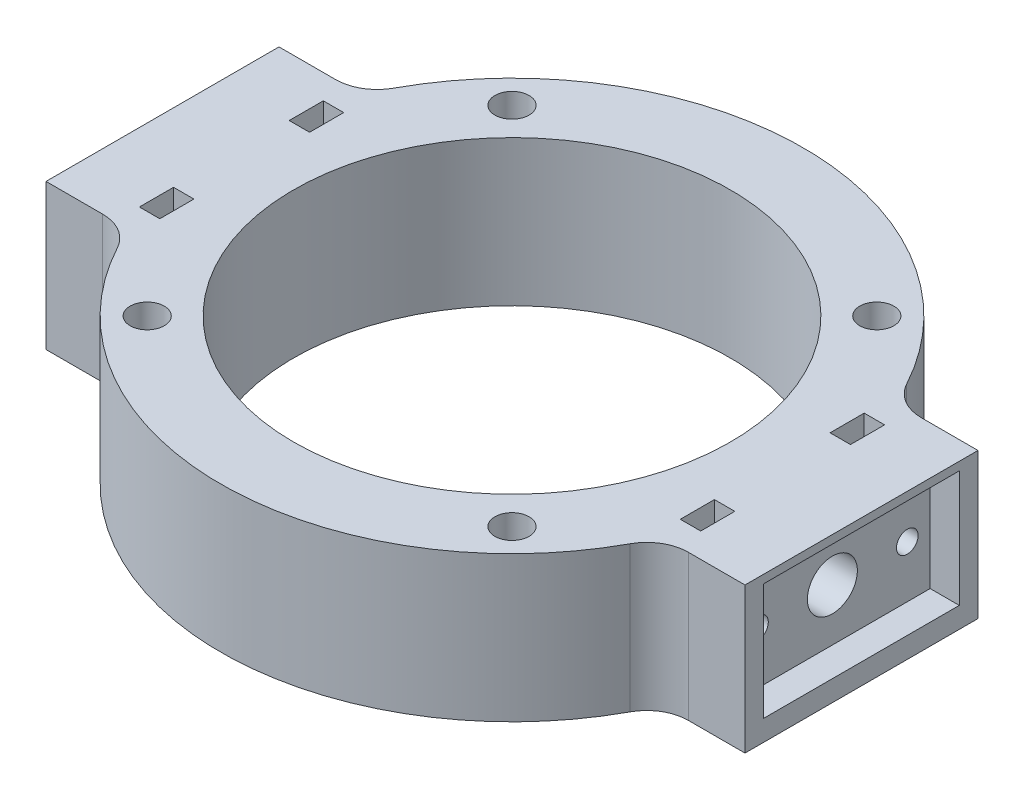
from build123d import *

# Parameters (mm, degrees)
IZIM1_R                     = 52.5
Y_KSEKLIK_EKSTR_ZYON1_DEPTH = 35
IZIM2_R                     = 6.01
KES_EKSTR_ZYON1_DEPTH       = 27.24
IZIM3_W                     = 47
IZIM3_H                     = 28
KES_EKSTR_ZYON2_DEPTH       = 7
IZIM4_R                     = 2.6
KES_EKSTR_ZYON3_DEPTH       = 20
KES_EKSTR_ZYON4_DEPTH       = 2.45
IZIM7_R                     = 4.1
KES_EKSTR_ZYON5_DEPTH       = 115.808536268
RADYUS1_R                   = 10


with BuildPart() as part:
    # Çizim1 → Yükseklik-Ekstrüzyon1 (new body)
    with BuildSketch(Plane(origin=(0, 0, 0), x_dir=(1, 0, 0), z_dir=(0, 1, 0))):
        with BuildLine():
            Line((-64.156059729, 28), (-84, 28))
            Line((-84, 28), (-84, -28))
            Line((-84, -28), (-64.156059729, -28))
            ThreePointArc((-64.156059729, -28), (0, -70), (64.156059729, -28))
            Line((64.156059729, -28), (84, -28))
            Line((84, -28), (84, 28))
            Line((84, 28), (64.156059729, 28))
            ThreePointArc((64.156059729, 28), (0, 70), (-64.156059729, 28))
        make_face()
        with Locations(Location((0, 0, 0), (0, 0, 270))):
            Circle(IZIM1_R, mode=Mode.SUBTRACT)
    extrude(amount=Y_KSEKLIK_EKSTR_ZYON1_DEPTH)

    # Çizim2 → Kes-Ekstrüzyon1 (cut)
    with BuildSketch(Plane(origin=(84, 0, 0), x_dir=(0, 0, -1), z_dir=(1, 0, 0))):
        with Locations((0, 17.5)):
            Circle(IZIM2_R)
    kes_ekstr_zyon1 = extrude(amount=-KES_EKSTR_ZYON1_DEPTH, mode=Mode.SUBTRACT)

    # Aynalama1: Kes-Ekstrüzyon1 across plane
    add(kes_ekstr_zyon1.mirror(Plane(origin=(0, 0, 0), x_dir=(0, 0, 1), z_dir=(1, 0, 0))), mode=Mode.SUBTRACT)

    # Çizim3 → Kes-Ekstrüzyon2 (cut)
    with BuildSketch(Plane(origin=(84, 0, 0), x_dir=(0, 0, -1), z_dir=(1, 0, 0))):
        with Locations((0, 19)):
            Rectangle(IZIM3_W, IZIM3_H)
    kes_ekstr_zyon2 = extrude(amount=-KES_EKSTR_ZYON2_DEPTH, mode=Mode.SUBTRACT)

    # Aynalama2: Kes-Ekstrüzyon2 across plane
    add(kes_ekstr_zyon2.mirror(Plane(origin=(0, 0, 0), x_dir=(0, 0, 1), z_dir=(1, 0, 0))), mode=Mode.SUBTRACT)

    # Çizim4 → Kes-Ekstrüzyon3 (cut)
    with BuildSketch(Plane(origin=(77, 0, 0), x_dir=(0, 0, -1), z_dir=(1, 0, 0))):
        with Locations((18, 17.5)):
            Circle(IZIM4_R)
        with Locations(Location((-18, 17.5, 0), (0, 0, 180))):
            Circle(IZIM4_R)
    kes_ekstr_zyon3 = extrude(amount=-KES_EKSTR_ZYON3_DEPTH, mode=Mode.SUBTRACT)

    # Aynalama3: Kes-Ekstrüzyon3 across plane
    add(kes_ekstr_zyon3.mirror(Plane(origin=(0, 0, 0), x_dir=(0, 0, 1), z_dir=(1, 0, 0))), mode=Mode.SUBTRACT)

    # Çizim6 → Kes-Ekstrüzyon4 (cut, symmetric)
    with BuildSketch(Plane.ZY.offset(65)):
        Polygon((-22.1, 35), (-13.9, 35), (-13.9, 15.132863896), (-18, 12.765727793), (-22.1, 15.132863896), align=None)
        Polygon((18, 12.765727793), (22.1, 15.132863896), (22.1, 35), (13.9, 35), (13.9, 15.132863896), align=None)
    kes_ekstr_zyon4 = extrude(amount=KES_EKSTR_ZYON4_DEPTH, both=True, mode=Mode.SUBTRACT)

    # Aynalama4: Kes-Ekstrüzyon4 across plane
    add(kes_ekstr_zyon4.mirror(Plane(origin=(0, 0, 0), x_dir=(0, 0, 1), z_dir=(1, 0, 0))), mode=Mode.SUBTRACT)

    # Çizim7 → Kes-Ekstrüzyon5 (cut, through all)
    with BuildSketch(Plane(origin=(0, 35, 0), x_dir=(1, 0, 0), z_dir=(0, 1, 0))):
        with Locations(Location((43.840620434, -43.840620434, 0), (0, 0, 270))):
            Circle(IZIM7_R)
        with Locations(Location((-43.840620434, -43.840620434, 0), (0, 0, 270))):
            Circle(IZIM7_R)
        with Locations(Location((-43.840620434, 43.840620434, 0), (0, 0, 270))):
            Circle(IZIM7_R)
        with Locations(Location((43.840620434, 43.840620434, 0), (0, 0, 270))):
            Circle(IZIM7_R)
    extrude(amount=-KES_EKSTR_ZYON5_DEPTH, mode=Mode.SUBTRACT)

    # Radyus1
    radyus1_edges = [part.edges().sort_by_distance(p)[0] for p in [
        (64.156059729, 17.5, -28),
        (64.156059729, 17.5, 28),
        (-64.156059729, 17.5, 28),
        (-64.156059729, 17.5, -28),
    ]]
    fillet(radyus1_edges, radius=RADYUS1_R)


solid = part.part
